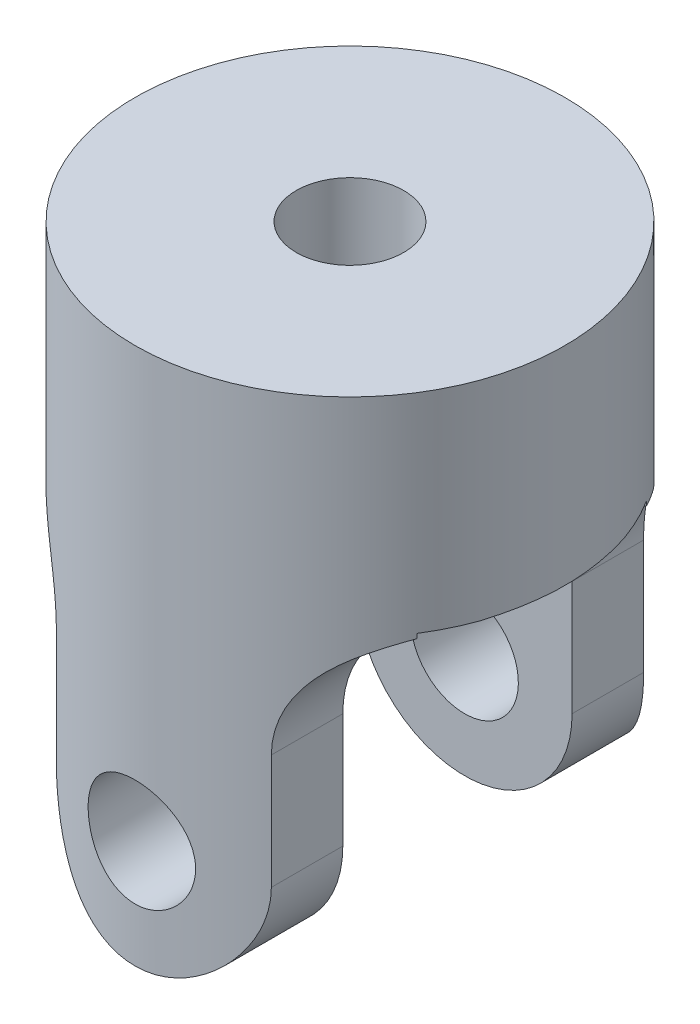
from build123d import *

# Parameters (mm, degrees)
SKETCH1_R               = 19.05
BASE_EXTRUDE_DEPTH      = 47.625
CUT_EXTRUDE1_DEPTH      = 55.716959208
CUT_EXTRUDE1_DEPTH_BACK = 55.716959208
CUT_EXTRUDE5_DEPTH      = 55.716959365
CUT_EXTRUDE5_DEPTH_BACK = 55.716959365
CUT_EXTRUDE6_DEPTH      = 55.716959365
CUT_EXTRUDE6_DEPTH_BACK = 55.716959365
SKETCH11_R              = 4.7625
SKETCH12_R              = 4.7625
CUT_EXTRUDE7_DEPTH      = 55.716959365


with BuildPart() as part:
    # Sketch1 → Base-Extrude (new body)
    with BuildSketch(Plane(origin=(0, 0, 0), x_dir=(-1, 0, 0), z_dir=(0, 1, 0))):
        with Locations(Location((0, 0, 0), (0, 0, 90))):
            Circle(SKETCH1_R)
    extrude(amount=BASE_EXTRUDE_DEPTH)

    # Sketch2 → Cut-Extrude1 (cut, two sides: drawn at the far end of the back side and taken through both)
    with BuildSketch(Plane.XY.offset(-CUT_EXTRUDE1_DEPTH_BACK)):
        with BuildLine():
            Line((-19.05, -131.979516723), (-19.05, 0))
            Line((-19.05, 0), (-19.05, 29.21))
            ThreePointArc((-19.05, 29.21), (-12.314807909, 26.420192091), (-9.525, 19.685))
            Line((-9.525, 19.685), (-9.525, 9.525))
            ThreePointArc((-9.525, 9.525), (0, 0), (9.525, 9.525))
            Line((9.525, 9.525), (9.525, 19.685))
            ThreePointArc((9.525, 19.685), (12.314807909, 26.420192091), (19.05, 29.21))
            Line((19.05, 29.21), (19.05, 0))
            Line((19.05, 0), (19.05, -131.979516723))
            Line((19.05, -131.979516723), (19.05, -395.938550169))
            Line((19.05, -395.938550169), (-19.05, -395.938550169))
            Line((-19.05, -395.938550169), (-19.05, -131.979516723))
        make_face()
    extrude(amount=CUT_EXTRUDE1_DEPTH + CUT_EXTRUDE1_DEPTH_BACK, mode=Mode.SUBTRACT)

    # Sketch8 → Cut-Extrude5 (cut, two sides: drawn at the far end of the back side and taken through both)
    with BuildSketch(Plane(origin=(0, 0, 0), x_dir=(0, 0, -1), z_dir=(1, 0, 0)).offset(-CUT_EXTRUDE5_DEPTH_BACK)):
        Polygon((-10.16, -121.738350451), (-10.16, 0), (-10.16, 29.145238826), (10.16, 29.145238826), (10.16, 0), (10.16, -121.738350451), (10.16, -365.215051352), (-10.16, -365.215051352), align=None)
    extrude(amount=CUT_EXTRUDE5_DEPTH + CUT_EXTRUDE5_DEPTH_BACK, mode=Mode.SUBTRACT)

    # Sketch11 → Cut-Extrude6 (cut, two sides: drawn at the far end of the back side and taken through both)
    with BuildSketch(Plane.XY.offset(-CUT_EXTRUDE6_DEPTH_BACK)):
        with Locations(Location((0, 9.525, 0), (0, 0, 90))):
            Circle(SKETCH11_R)
    extrude(amount=CUT_EXTRUDE6_DEPTH + CUT_EXTRUDE6_DEPTH_BACK, mode=Mode.SUBTRACT)

    # Sketch12 → Cut-Extrude7 (cut, through all)
    with BuildSketch(Plane(origin=(0, 47.625, 0), x_dir=(-1, 0, 0), z_dir=(0, 1, 0))):
        with Locations(Location((0, 0, 0), (0, 0, 90))):
            Circle(SKETCH12_R)
    extrude(amount=-CUT_EXTRUDE7_DEPTH, mode=Mode.SUBTRACT)


solid = part.part
